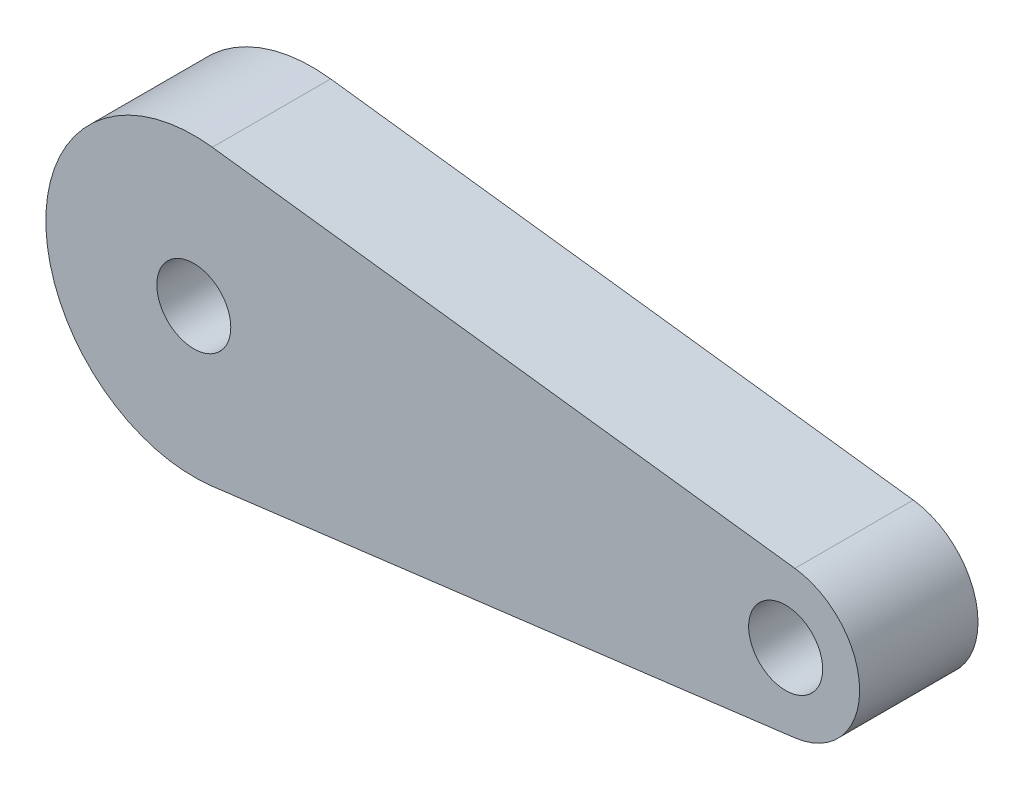
from build123d import *

# Parameters (mm, degrees)
SKETCH_2_R      = 2.5
EXTRUDE_1_DEPTH = 8


with BuildPart() as part:
    # 草图2 → 凸台-拉伸1 (new body)
    with BuildSketch(Plane.XY):
        with BuildLine():
            Line((40.625, 4.960783708), (1.25, 9.921567416))
            ThreePointArc((1.25, 9.921567416), (-10, 0), (1.25, -9.921567416))
            Line((1.25, -9.921567416), (40.625, -4.960783708))
            ThreePointArc((40.625, -4.960783708), (45, 0), (40.625, 4.960783708))
        make_face()
        with Locations((40, 0)):
            Circle(SKETCH_2_R, mode=Mode.SUBTRACT)
        Circle(SKETCH_2_R, mode=Mode.SUBTRACT)
    extrude(amount=EXTRUDE_1_DEPTH)


solid = part.part
